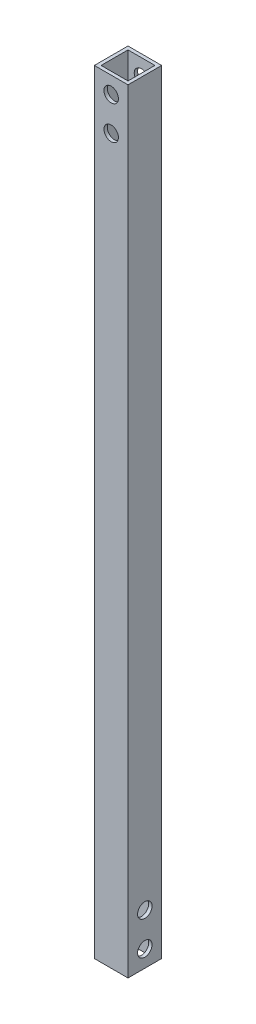
from build123d import *

# Parameters (mm, degrees)
SKETCH_1_W          = 10
SKETCH_1_H          = 10
SKETCH_1_W_2        = 8
SKETCH_1_H_2        = 8
EXTRUDE_1_DEPTH     = 230
SKETCH_2_R          = 2.15
CUT_EXTRUDE_1_DEPTH = 231.271578793
SKETCH_3_R          = 2.15
CUT_EXTRUDE_2_DEPTH = 231.271578793


with BuildPart() as part:
    # ｽｹｯﾁ1 → 押し出し-薄板1 (new body)
    with BuildSketch(Plane(origin=(0, 0, 0), x_dir=(1, 0, 0), z_dir=(0, 1, 0))):
        Rectangle(SKETCH_1_W, SKETCH_1_H)
        Rectangle(SKETCH_1_W_2, SKETCH_1_H_2, mode=Mode.SUBTRACT)
    extrude(amount=EXTRUDE_1_DEPTH)

    # ｽｹｯﾁ2 → ｶｯﾄ - 押し出し1 (cut, through all)
    with BuildSketch(Plane(origin=(0, 0, 5), x_dir=(-1, 0, 0), z_dir=(0, 0, -1))):
        with Locations((0, 215)):
            Circle(SKETCH_2_R)
        with Locations((0, 225)):
            Circle(SKETCH_2_R)
    extrude(amount=CUT_EXTRUDE_1_DEPTH, mode=Mode.SUBTRACT)

    # ｽｹｯﾁ3 → ｶｯﾄ - 押し出し2 (cut, through all)
    with BuildSketch(Plane(origin=(5, 0, 0), x_dir=(0, 0, -1), z_dir=(1, 0, 0))):
        with Locations((0, 15)):
            Circle(SKETCH_3_R)
        with Locations((0, 5)):
            Circle(SKETCH_3_R)
    extrude(amount=-CUT_EXTRUDE_2_DEPTH, mode=Mode.SUBTRACT)


solid = part.part
